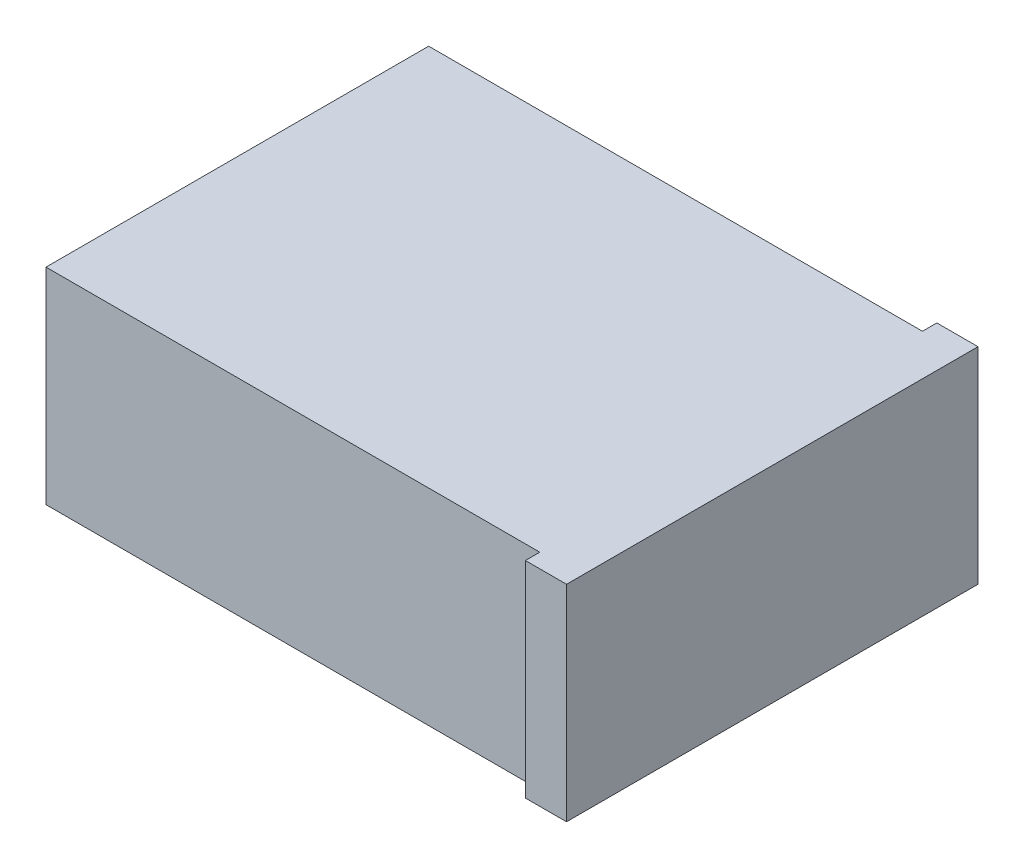
from build123d import *

# Parameters (mm, degrees)
EXTRUDE_1_DEPTH = 50


with BuildPart() as part:
    # 草图1 → 凸台-拉伸1 (new body)
    with BuildSketch(Plane(origin=(0, 0, 0), x_dir=(1, 0, 0), z_dir=(0, 1, 0))):
        Polygon((55, 46.5), (55, 50), (65, 50), (65, -50), (55, -50), (55, -46.5), (-65, -46.5), (-65, 46.5), align=None)
    extrude(amount=EXTRUDE_1_DEPTH)


solid = part.part
